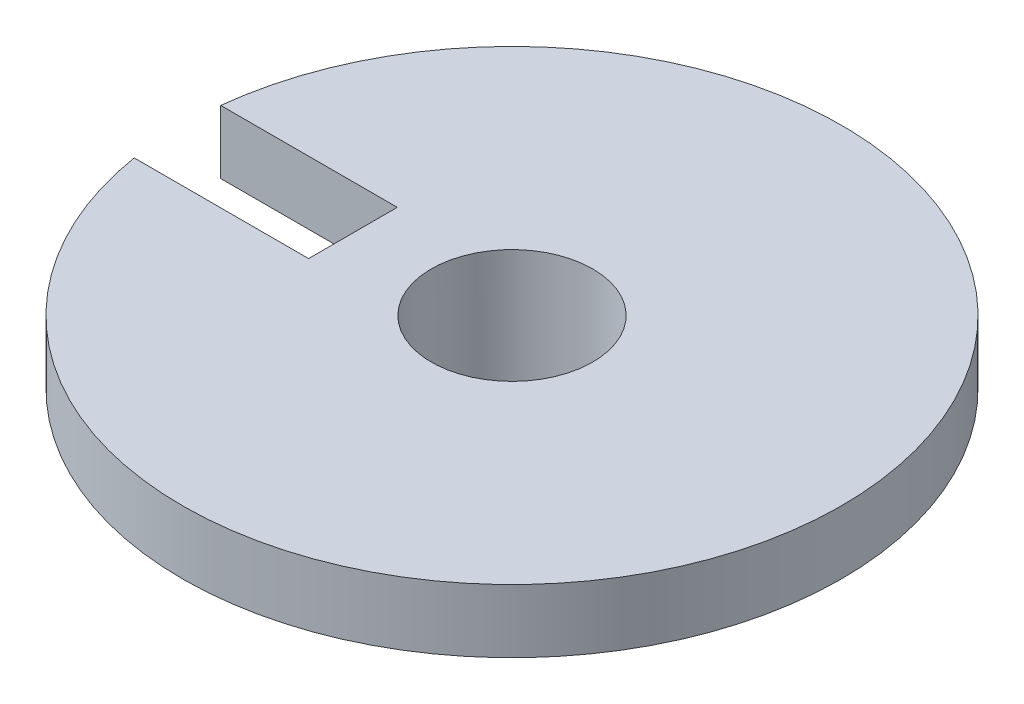
from build123d import *

# Parameters (mm, degrees)
SKETCH1_R           = 5.685
SKETCH1_R_2         = 3.185
BOSS_EXTRUDE1_DEPTH = 4.46
SKETCH2_R           = 13
BOSS_EXTRUDE2_DEPTH = 2.5
SKETCH3_R           = 3.185
CUT_EXTRUDE1_DEPTH  = 2.5
SKETCH4_W           = 8.515099108
SKETCH4_H           = 3.5
CUT_EXTRUDE2_DEPTH  = 10


with BuildPart() as part:
    # Sketch1 → Boss-Extrude1 (new body)
    with BuildSketch(Plane(origin=(0, 0, 0), x_dir=(1, 0, 0), z_dir=(0, 1, 0))):
        with Locations(Location((0, 0, 0), (0, 0, 270))):
            Circle(SKETCH1_R)
        with Locations(Location((0, 0, 0), (0, 0, 270))):
            Circle(SKETCH1_R_2, mode=Mode.SUBTRACT)
    extrude(amount=BOSS_EXTRUDE1_DEPTH)

    # Sketch2 → Boss-Extrude2 (add)
    with BuildSketch(Plane(origin=(0, 4.46, 0), x_dir=(1, 0, 0), z_dir=(0, 1, 0))):
        with Locations(Location((0, 0, 0), (0, 0, 270))):
            Circle(SKETCH2_R)
    extrude(amount=BOSS_EXTRUDE2_DEPTH)

    # Sketch3 → Cut-Extrude1 (cut)
    with BuildSketch(Plane.XZ.offset(-4.46)):
        with Locations(Location((0, 0, 0), (0, 0, 270))):
            Circle(SKETCH3_R)
    extrude(amount=-CUT_EXTRUDE1_DEPTH, mode=Mode.SUBTRACT)

    # Sketch4 → Cut-Extrude2 (cut)
    with BuildSketch(Plane.XZ.offset(-4.46)):
        with Locations((-10.213773727, 0.31798138)):
            Rectangle(SKETCH4_W, SKETCH4_H)
    extrude(amount=-CUT_EXTRUDE2_DEPTH, mode=Mode.SUBTRACT)


solid = part.part
